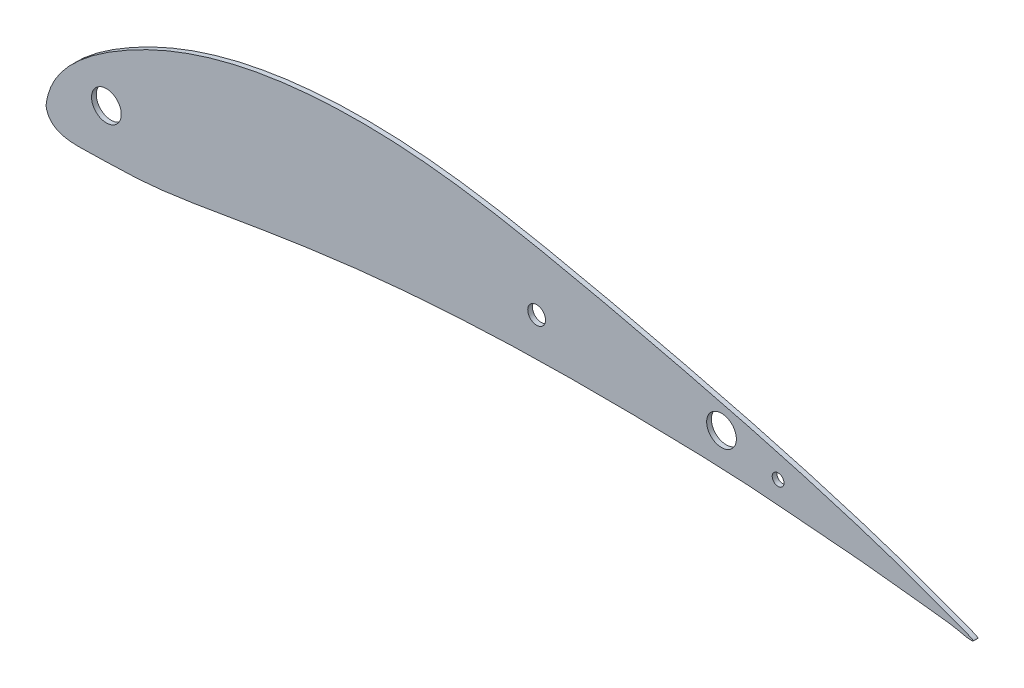
from build123d import *

# Parameters (mm, degrees)
BOSS_EXTRUDE1_DEPTH = 1.5875
SKETCH2_R           = 5
SKETCH2_R_2         = 1.984375
CUT_EXTRUDE1_DEPTH  = 316.731983488
SKETCH3_R           = 3
CUT_EXTRUDE2_DEPTH  = 2.54


with BuildPart() as part:
    # Sketch1 → Boss-Extrude1 (new body)
    with BuildSketch(Plane.XY):
        with BuildLine():
            add(Edge.make_bspline(
                [(0.000560351, 0.000130087), (0.810633127, 7.359196055), (8.649092025, 17.856605174), (26.286719818, 29.975176328), (52.111128271, 42.069215275), (89.597618475, 49.290763054), (131.400792109, 47.884831915), (173.256699242, 40.041104278), (217.961060472, 29.612974894), (256.952064401, 19.528920948), (290.35983767, 8.71099439), (301.273197721, 4.382828139), (314.816918223, -0.516206742), (309.846313895, 0.000130087)],
                knots=[0, 0, 0, 0, 0.060863618, 0.113688265, 0.188608742, 0.312908923, 0.448482434, 0.557612135, 0.691544113, 0.852438279, 0.92975597, 0.976058229, 1, 1, 1, 1], degree=3))
            add(Edge.make_bspline(
                [(309.846313895, 0.000130087), (303.956832565, 1.47095521), (293.989507544, 2.093987313), (276.26402299, 4.514356704), (260.846344817, 5.427413394), (235.858814759, 7.870306192), (205.101424636, 8.838080282), (157.718638092, 9.030650149), (110.497331172, 6.181495223), (66.506197185, -0.586669107), (36.454672816, -6.098499901), (15.316603331, -6.189065841), (1.230714189, -6.924076091), (0.000560351, 0.000130087)],
                knots=[0, 0, 0, 0, 0.057787081, 0.095274891, 0.171021118, 0.205339302, 0.335319146, 0.464904334, 0.658702312, 0.785511947, 0.893517288, 0.94309214, 1, 1, 1, 1], degree=3))
        make_face()
    extrude(amount=BOSS_EXTRUDE1_DEPTH)

    # Sketch2 → Cut-Extrude1 (cut, through all)
    with BuildSketch(Plane.XY.offset(1.5875)):
        with Locations((20.32, 10.16)):
            Circle(SKETCH2_R)
        with Locations((227.296313895, 19.050130087)):
            Circle(SKETCH2_R)
        with Locations((246.346313895, 14.224130087)):
            Circle(SKETCH2_R_2)
    extrude(amount=-CUT_EXTRUDE1_DEPTH, mode=Mode.SUBTRACT)

    # Sketch3 → Cut-Extrude2 (cut)
    with BuildSketch(Plane(origin=(0, 0, 0), x_dir=(-1, 0, 0), z_dir=(0, 0, -1))):
        with Locations((-165.100560351, 21.590130087)):
            Circle(SKETCH3_R)
    extrude(amount=-CUT_EXTRUDE2_DEPTH, mode=Mode.SUBTRACT)


solid = part.part
